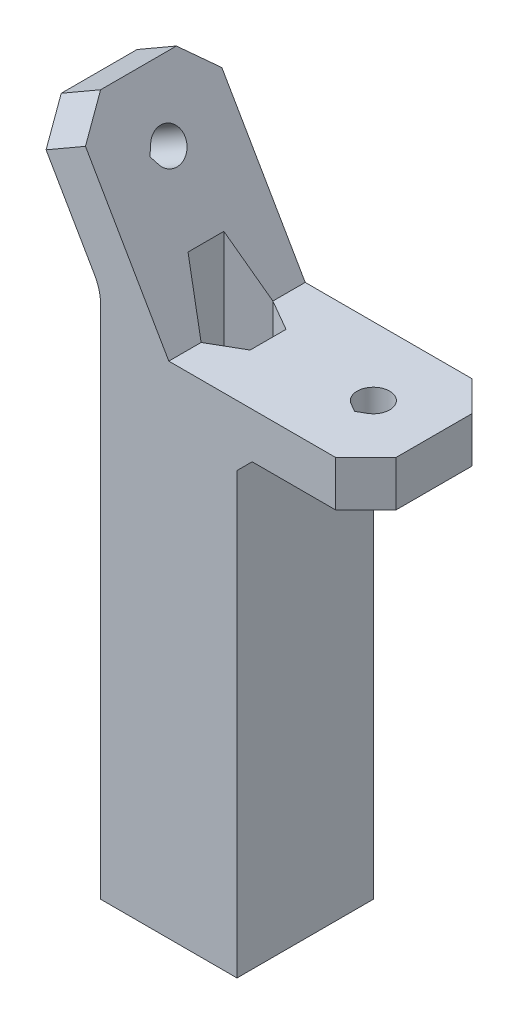
from build123d import *

# Parameters (mm, degrees)
BOSS_EXTRUDE1_DEPTH = 9
SKETCH2_R           = 2.15
CUT_EXTRUDE1_DEPTH  = 39.159314511
SKETCH3_R           = 2.15
CUT_EXTRUDE2_DEPTH  = 37.346022079
BOSS_EXTRUDE2_DEPTH = 18
CHAMFER1_SIZE       = 4
CHAMFER2_SIZE       = 2
FILLET1_R           = 6
CUT_EXTRUDE3_DEPTH  = 69.109715592
CUT_EXTRUDE4_DEPTH  = 73.836345899
SKETCH7_R           = 2.65
CUT_EXTRUDE5_DEPTH  = 94.724769777
CUT_EXTRUDE6_START  = -6
CUT_EXTRUDE6_DEPTH  = 88.724769777
CUT_EXTRUDE7_DEPTH  = 94.724769777


with BuildPart() as part:
    # Sketch1 → Boss-Extrude1 (new, symmetric)
    with BuildSketch(Plane.XY):
        Polygon((-14.732050808, 25.516660498), (0, 0), (29.464101615, 0), (29.464101615, 6), (3.464101615, 6), (-9.535898385, 28.516660498), align=None)
    extrude(amount=BOSS_EXTRUDE1_DEPTH, both=True)

    # Sketch2 → Cut-Extrude1 (cut, through all)
    with BuildSketch(Plane(origin=(0, 6, 0), x_dir=(1, 0, 0), z_dir=(0, 1, 0))):
        with Locations(Location((21.464101615, 0, 0), (0, 0, 270))):
            Circle(SKETCH2_R)
    extrude(amount=-CUT_EXTRUDE1_DEPTH, mode=Mode.SUBTRACT)

    # Sketch3 → Cut-Extrude2 (cut, through all)
    with BuildSketch(Plane(origin=(5.196152423, 3, 0), x_dir=(0, 0, -1), z_dir=(0.8660254037844397, 0.499999999999998, 0))):
        with Locations(Location((0, 21.464101615, 0), (0, 0, 90))):
            Circle(SKETCH3_R)
    extrude(amount=-CUT_EXTRUDE2_DEPTH, mode=Mode.SUBTRACT)

    # Sketch4 → Boss-Extrude2 (add)
    with BuildSketch(Plane(origin=(0, 0, -9), x_dir=(-1, 0, 0), z_dir=(0, 0, -1))):
        Polygon((0, 0), (-12.464101615, 0), (-12.464101615, -60), (5.535898385, -60), (5.535898385, 9.588457268), align=None)
    extrude(amount=-BOSS_EXTRUDE2_DEPTH)

    # Chamfer1
    chamfer1_edges = [part.edges().sort_by_distance(p)[0] for p in [
        (29.464101615, 3, 9),
        (-12.133974596, 27.016660498, 9),
        (29.464101615, 3, -9),
        (-12.133974596, 27.016660498, -9),
    ]]
    chamfer(chamfer1_edges, length=CHAMFER1_SIZE)

    # Chamfer2
    chamfer2_edges = [part.edges().sort_by_distance(p)[0] for p in [
        (12.464101615, 0, 0),
    ]]
    chamfer(chamfer2_edges, length=CHAMFER2_SIZE)

    # Fillet1
    fillet1_edges = [part.edges().sort_by_distance(p)[0] for p in [
        (-5.535898385, 9.588457268, 0),
    ]]
    fillet(fillet1_edges, radius=FILLET1_R)

    # Sketch5 → Cut-Extrude3 (cut, through all)
    with BuildSketch(Plane(origin=(5.196152423, 3, 0), x_dir=(0, 0, -1), z_dir=(0.8660254037844397, 0.4999999999999981, 0))):
        Polygon((-1.861954618, 22.539101615), (-2.482606158, 21.464101615), (-1.861954618, 20.389101615), align=None)
    extrude(amount=-CUT_EXTRUDE3_DEPTH, mode=Mode.SUBTRACT)

    # Sketch6 → Cut-Extrude4 (cut, through all)
    with BuildSketch(Plane(origin=(0, 6, 0), x_dir=(1, 0, 0), z_dir=(0, 1, 0))):
        Polygon((22.539101615, -1.861954618), (21.464101615, -2.482606158), (20.389101615, -1.861954618), align=None)
    extrude(amount=-CUT_EXTRUDE4_DEPTH, mode=Mode.SUBTRACT)

    # Sketch7 → Cut-Extrude5 (cut, through all)
    with BuildSketch(Plane.XZ.offset(60)):
        with Locations(Location((3.464101615, 0, 0), (0, 0, 270))):
            Circle(SKETCH7_R)
    extrude(amount=-CUT_EXTRUDE5_DEPTH, mode=Mode.SUBTRACT)

    # Sketch8 → Cut-Extrude6 (cut, through all)
    with BuildSketch(Plane.XZ.offset(60).offset(CUT_EXTRUDE6_START)):
        Polygon((3.464101615, 4.734272207), (-0.635898385, 2.367136104), (-0.635898385, -2.367136104), (3.464101615, -4.734272207), (7.564101615, -2.367136104), (7.564101615, 2.367136104), align=None)
    extrude(amount=-CUT_EXTRUDE6_DEPTH, mode=Mode.SUBTRACT)

    # Sketch10 → Cut-Extrude7 (cut, through all)
    with BuildSketch(Plane.XZ.offset(60)):
        Polygon((2.139101615, 2.29496732), (3.464101615, 3.059956427), (4.789101615, 2.29496732), align=None)
    extrude(amount=-CUT_EXTRUDE7_DEPTH, mode=Mode.SUBTRACT)


solid = part.part
